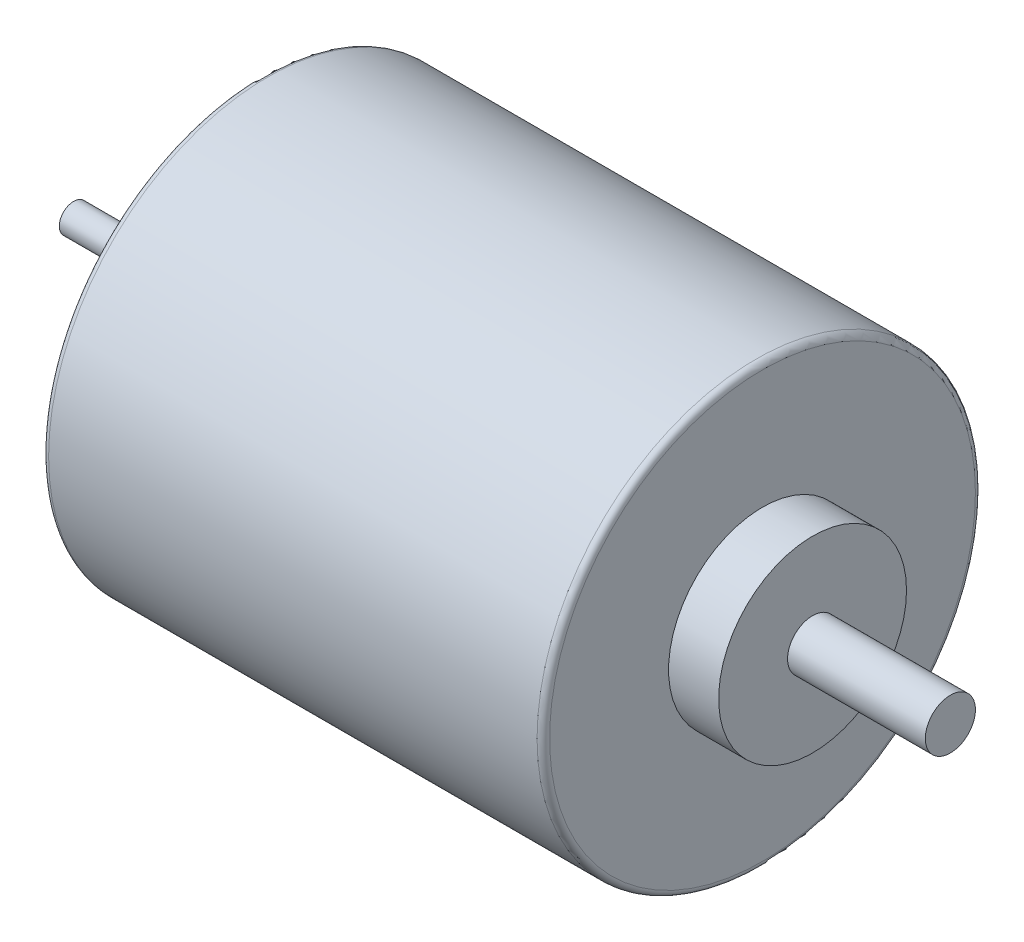
from build123d import *

# Parameters (mm, degrees)
CROQUIS1_R              = 17.5
SALIENTE_EXTRUIR1_DEPTH = 40
CROQUIS3_R              = 2
SALIENTE_EXTRUIR2_DEPTH = 15
CROQUIS4_R              = 7.5
SALIENTE_EXTRUIR3_DEPTH = 4
CROQUIS5_R              = 1.145
SALIENTE_EXTRUIR4_DEPTH = 15
REDONDEO1_R             = 0.5
REDONDEO2_R             = 0.5


with BuildPart() as part:
    # Croquis1 → Saliente-Extruir1 (new body)
    with BuildSketch(Plane(origin=(0, 0, 0), x_dir=(0, 0, -1), z_dir=(1, 0, 0))):
        Circle(CROQUIS1_R)
    extrude(amount=SALIENTE_EXTRUIR1_DEPTH)

    # Redondeo1
    redondeo1_edges = [part.edges().sort_by_distance(p)[0] for p in [
        (0, 0, 17.5),
    ]]
    fillet(redondeo1_edges, radius=REDONDEO1_R)

    # Redondeo2
    redondeo2_edges = [part.edges().sort_by_distance(p)[0] for p in [
        (40, 0, 17.5),
    ]]
    fillet(redondeo2_edges, radius=REDONDEO2_R)


with BuildPart() as body_2:
    # Croquis3 → Saliente-Extruir2 (new body)
    with BuildSketch(Plane(origin=(40, 0, 0), x_dir=(0, 0, -1), z_dir=(1, 0, 0))):
        Circle(CROQUIS3_R)
    extrude(amount=SALIENTE_EXTRUIR2_DEPTH)


with BuildPart() as body_3:
    # Croquis4 → Saliente-Extruir3 (new body)
    with BuildSketch(Plane(origin=(40, 0, 0), x_dir=(0, 0, -1), z_dir=(1, 0, 0))):
        Circle(CROQUIS4_R)
    extrude(amount=SALIENTE_EXTRUIR3_DEPTH)


with BuildPart() as body_4:
    # Croquis5 → Saliente-Extruir4 (new body)
    with BuildSketch(Plane.ZY):
        Circle(CROQUIS5_R)
    extrude(amount=SALIENTE_EXTRUIR4_DEPTH)


solid = Compound([part.part, body_2.part, body_3.part, body_4.part])
